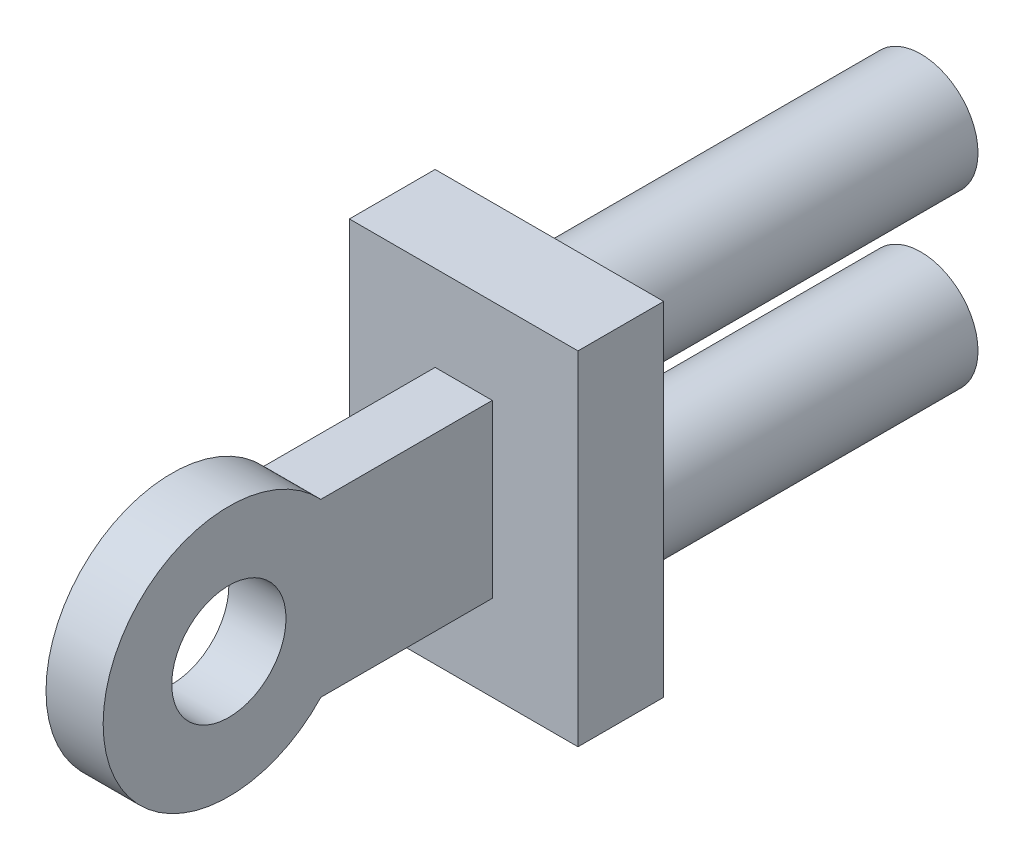
from build123d import *

# Parameters (mm, degrees)
SKETCH1_W                = 4
SKETCH1_H                = 6
BOSS_EXTRUDE1_DEPTH      = 1.5
BOSS_EXTRUDE2_DEPTH      = 0.5
BOSS_EXTRUDE2_DEPTH_BACK = 0.5
BOSS_EXTRUDE2_START      = -2
SKETCH2_R                = 1
SKETCH3_R                = 1
BOSS_EXTRUDE3_DEPTH      = 6.5


with BuildPart() as part:
    # Sketch1 → Boss-Extrude1 (new body)
    with BuildSketch(Plane.XY):
        Rectangle(SKETCH1_W, SKETCH1_H)
    extrude(amount=BOSS_EXTRUDE1_DEPTH)

    # Sketch2 → Boss-Extrude2 (add, two sides: drawn at the far end of the back side and taken through both)
    with BuildSketch(Plane(origin=(2, 0, 0), x_dir=(0, 0, -1), z_dir=(1, 0, 0)).offset(BOSS_EXTRUDE2_START - BOSS_EXTRUDE2_DEPTH_BACK)):
        with BuildLine():
            Line((-1.5, 1.5), (-4.5, 1.5))
            ThreePointArc((-4.5, 1.5), (-8.309347694, 0), (-4.5, -1.5))
            Line((-4.5, -1.5), (-1.5, -1.5))
            Line((-1.5, -1.5), (-1.5, 1.5))
        make_face()
        with Locations((-6.109347694, 0)):
            Circle(SKETCH2_R, mode=Mode.SUBTRACT)
    extrude(amount=BOSS_EXTRUDE2_DEPTH + BOSS_EXTRUDE2_DEPTH_BACK)

    # Sketch3 → Boss-Extrude3 (add)
    with BuildSketch(Plane(origin=(0, 0, 0), x_dir=(-1, 0, 0), z_dir=(0, 0, -1))):
        with Locations(Location((0, 1.5, 0), (0, 0, 180))):
            Circle(SKETCH3_R)
        with Locations(Location((0, -1.5, 0), (0, 0, 180))):
            Circle(SKETCH3_R)
    extrude(amount=BOSS_EXTRUDE3_DEPTH)


solid = part.part
